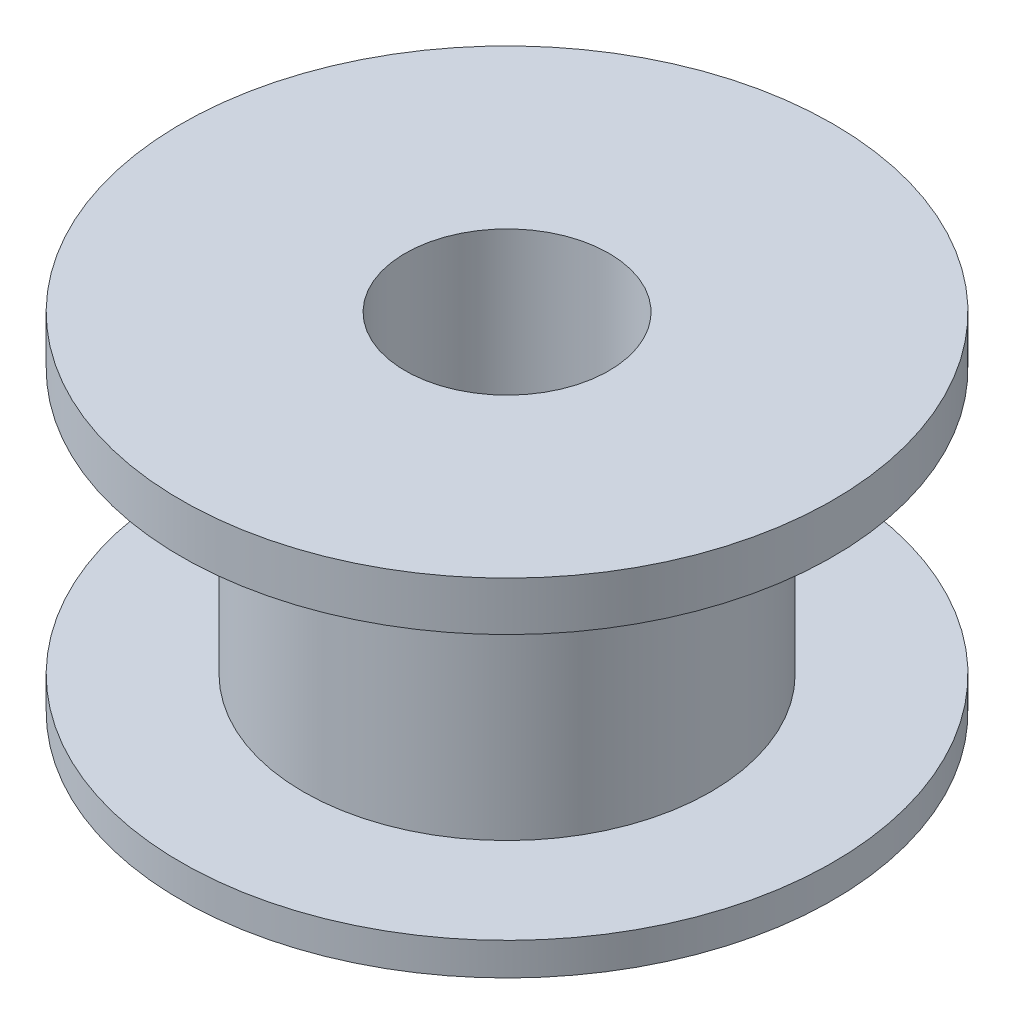
from build123d import *


with BuildPart() as part:
    # Sketch1 → Revolve1 (revolve)
    with BuildSketch(Plane.XY, mode=Mode.PRIVATE) as revolve1_sk:
        Polygon((2.5, -4.25), (2.5, 4.25), (8, 4.25), (8, 3.05), (5, 3.05), (5, -3.45), (8, -3.45), (8, -4.25), align=None)
    revolve(revolve1_sk.sketch.rotate(Axis((0, -4.881528906, 0), (0, 1, 0)), 90), axis=Axis((0, -4.881528906, 0), (0, 1, 0)))


solid = part.part
